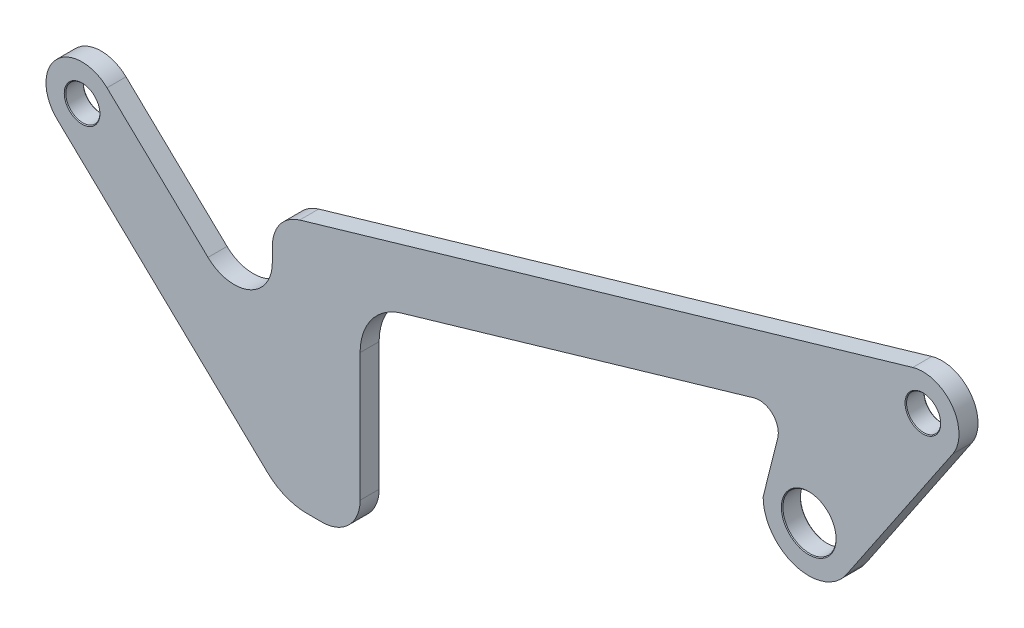
from build123d import *

# Parameters (mm, degrees)
SKETCH1_R           = 6.99
SKETCH1_R_2         = 4.49
BOSS_EXTRUDE1_DEPTH = 5
CHAMFER1_SIZE       = 0.2
CHAMFER2_SIZE       = 0.2
CHAMFER3_SIZE       = 0.2


with BuildPart() as part:
    # Sketch1 → Boss-Extrude1 (new body)
    with BuildSketch(Plane.XY):
        with BuildLine():
            Line((-133.800547442, 2.100285816), (27.342280478, 49.110248457))
            ThreePointArc((27.342280478, 49.110248457), (37.664916823, 45.595457988), (37.867204061, 34.692721954))
            Line((37.867204061, 34.692721954), (9.939702497, -6.705401873))
            ThreePointArc((9.939702497, -6.705401873), (-3.505928341, -11.465974292), (-11.99, 0))
            Line((-11.99, 0), (-8.148421767, 15.289860915))
            ThreePointArc((-8.148421767, 15.289860915), (-9.52943302, 20.109783701), (-14.397978323, 21.308163599))
            Line((-14.397978323, 21.308163599), (-107.124555833, -5.742825892))
            ThreePointArc((-107.124555833, -5.742825892), (-114.923991281, -11.142928518), (-117.92373467, -20.142586361))
            Line((-117.92373467, -20.142586361), (-117.92373467, -53.749229456))
            ThreePointArc((-117.92373467, -53.749229456), (-120.852666858, -60.820297268), (-127.92373467, -63.749229456))
            Line((-127.92373467, -63.749229456), (-131.916457627, -63.749229456))
            ThreePointArc((-131.916457627, -63.749229456), (-137.493140936, -62.674049142), (-142.270365562, -59.602643226))
            Line((-142.270365562, -59.602643226), (-197.550572421, -6.866593112))
            ThreePointArc((-197.550572421, -6.866593112), (-197.866593112, 6.550572421), (-184.449427579, 6.866593112))
            Line((-184.449427579, 6.866593112), (-157.90260529, -18.4584668))
            ThreePointArc((-157.90260529, -18.4584668), (-147.064650772, -20.415954294), (-141, -11.22285762))
            Line((-141, -11.22285762), (-141, -7.499554497))
            ThreePointArc((-141, -7.499554497), (-139.000171074, -1.499782602), (-133.800547442, 2.100285816))
        make_face()
        Circle(SKETCH1_R, mode=Mode.SUBTRACT)
        with Locations((-191, 0)):
            Circle(SKETCH1_R_2, mode=Mode.SUBTRACT)
        with Locations((30, 40)):
            Circle(SKETCH1_R_2, mode=Mode.SUBTRACT)
    extrude(amount=BOSS_EXTRUDE1_DEPTH)

    # Chamfer1
    chamfer1_edges = [part.edges().sort_by_distance(p)[0] for p in [
        (-195.49, 0, 0),
        (-195.49, 0, 5),
    ]]
    chamfer(chamfer1_edges, length=CHAMFER1_SIZE)

    # Chamfer2
    chamfer2_edges = [part.edges().sort_by_distance(p)[0] for p in [
        (-6.99, 0, 0),
        (-6.99, 0, 5),
    ]]
    chamfer(chamfer2_edges, length=CHAMFER2_SIZE)

    # Chamfer3
    chamfer3_edges = [part.edges().sort_by_distance(p)[0] for p in [
        (25.51, 40, 0),
        (25.51, 40, 5),
    ]]
    chamfer(chamfer3_edges, length=CHAMFER3_SIZE)


solid = part.part
